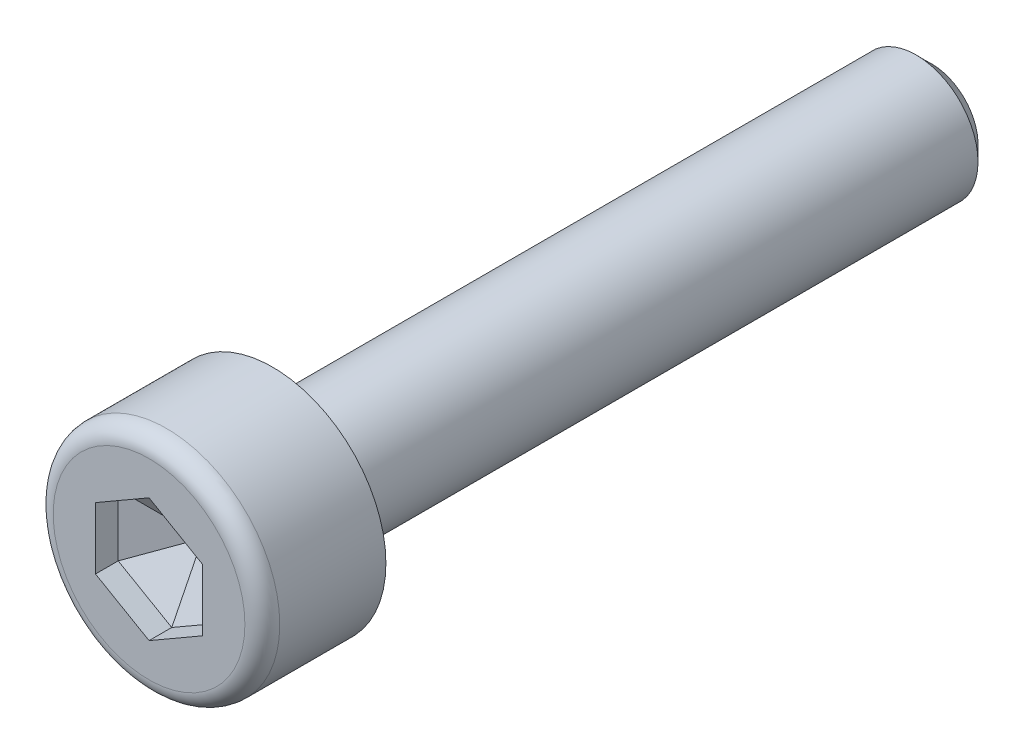
from build123d import *
from OCP.BRepFilletAPI import BRepFilletAPI_MakeChamfer

# Parameters (mm, degrees)
SKETCH_1_R          = 2.75
EXTRUDE_1_DEPTH     = 3
CUT_EXTRUDE_1_DEPTH = 1.3
SKETCH_3_R          = 1.5
EXTRUDE_2_DEPTH     = 16
CHAMFER_1_SIZE      = 0.375
FILLET_1_R          = 0.423076923
CHAMFER_2_SIZE      = 0.749279539
CHAMFER_2_SIZE2     = 1.29779023
FILLET_2_R          = 0.1


with BuildPart() as part:
    # 草图1 → 凸台-拉伸1 (new body)
    with BuildSketch(Plane.XY):
        Circle(SKETCH_1_R)
    extrude(amount=EXTRUDE_1_DEPTH)

    # 草图2 → 切除-拉伸1 (cut)
    with BuildSketch(Plane.XY.offset(3)):
        Polygon((1.3, 0.75055535), (0, 1.5011107), (-1.3, 0.75055535), (-1.3, -0.75055535), (0, -1.5011107), (1.3, -0.75055535), align=None)
    extrude(amount=-CUT_EXTRUDE_1_DEPTH, mode=Mode.SUBTRACT)

    # 草图3 → 凸台-拉伸2 (add)
    with BuildSketch(Plane(origin=(0, 0, 0), x_dir=(-1, 0, 0), z_dir=(0, 0, -1))):
        Circle(SKETCH_3_R)
    extrude(amount=EXTRUDE_2_DEPTH)

    # 倒角1
    chamfer_1_edges = [part.edges().sort_by_distance(p)[0] for p in [
        (1.5, 0, -16),
    ]]
    chamfer(chamfer_1_edges, length=CHAMFER_1_SIZE)

    # 圆角1
    fillet_1_edges = [part.edges().sort_by_distance(p)[0] for p in [
        (-2.75, 0, 3),
    ]]
    fillet(fillet_1_edges, radius=FILLET_1_R)

    # 倒角2: one chamfer whose edges measure the first distance from different faces: ONE call of the kernel's chamfer builder (chamfer() names one face for all edges)
    chamfer_2_edges_1 = [part.edges().sort_by_distance(p)[0] for p in [
        (-1.3, 0, 1.7),
    ]]
    chamfer_2_side_1 = [part.faces().sort_by_distance(p)[0] for p in [
        (-1.3, 0, 2.35),
    ]]
    chamfer_2_edges_2 = [part.edges().sort_by_distance(p)[0] for p in [
        (-0.65, 1.125833025, 1.7),
    ]]
    chamfer_2_side_2 = [part.faces().sort_by_distance(p)[0] for p in [
        (-0.65, 1.125833025, 2.35),
    ]]
    chamfer_2_edges_3 = [part.edges().sort_by_distance(p)[0] for p in [
        (0.65, 1.125833025, 1.7),
    ]]
    chamfer_2_side_3 = [part.faces().sort_by_distance(p)[0] for p in [
        (0.65, 1.125833025, 2.35),
    ]]
    chamfer_2_edges_4 = [part.edges().sort_by_distance(p)[0] for p in [
        (1.3, 0, 1.7),
    ]]
    chamfer_2_side_4 = [part.faces().sort_by_distance(p)[0] for p in [
        (1.3, 0, 2.35),
    ]]
    chamfer_2_edges_5 = [part.edges().sort_by_distance(p)[0] for p in [
        (-0.65, -1.125833025, 1.7),
    ]]
    chamfer_2_side_5 = [part.faces().sort_by_distance(p)[0] for p in [
        (-0.65, -1.125833025, 2.35),
    ]]
    chamfer_2_edges_6 = [part.edges().sort_by_distance(p)[0] for p in [
        (0.65, -1.125833025, 1.7),
    ]]
    chamfer_2_side_6 = [part.faces().sort_by_distance(p)[0] for p in [
        (0.65, -1.125833025, 2.35),
    ]]
    chamfer_2 = BRepFilletAPI_MakeChamfer(part.part.solid().wrapped)
    for e in chamfer_2_edges_1:
        chamfer_2.Add(CHAMFER_2_SIZE, CHAMFER_2_SIZE2, e.wrapped, chamfer_2_side_1[0].wrapped)  # the first distance lies on this face
    for e in chamfer_2_edges_2:
        chamfer_2.Add(CHAMFER_2_SIZE, CHAMFER_2_SIZE2, e.wrapped, chamfer_2_side_2[0].wrapped)  # the first distance lies on this face
    for e in chamfer_2_edges_3:
        chamfer_2.Add(CHAMFER_2_SIZE, CHAMFER_2_SIZE2, e.wrapped, chamfer_2_side_3[0].wrapped)  # the first distance lies on this face
    for e in chamfer_2_edges_4:
        chamfer_2.Add(CHAMFER_2_SIZE, CHAMFER_2_SIZE2, e.wrapped, chamfer_2_side_4[0].wrapped)  # the first distance lies on this face
    for e in chamfer_2_edges_5:
        chamfer_2.Add(CHAMFER_2_SIZE, CHAMFER_2_SIZE2, e.wrapped, chamfer_2_side_5[0].wrapped)  # the first distance lies on this face
    for e in chamfer_2_edges_6:
        chamfer_2.Add(CHAMFER_2_SIZE, CHAMFER_2_SIZE2, e.wrapped, chamfer_2_side_6[0].wrapped)  # the first distance lies on this face
    add(Compound.cast(chamfer_2.Shape()), mode=Mode.REPLACE)

    # 圆角2
    fillet_2_edges = [part.edges().sort_by_distance(p)[0] for p in [
        (1.5, 0, 0),
    ]]
    fillet(fillet_2_edges, radius=FILLET_2_R)


solid = part.part
